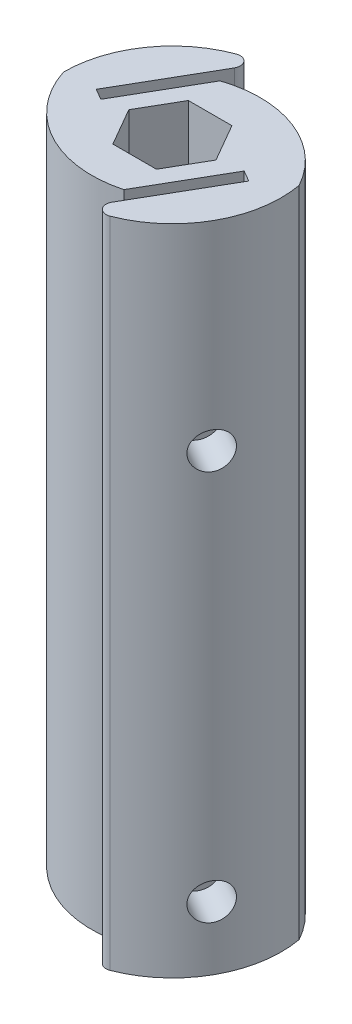
from build123d import *

# Parameters (mm, degrees)
BOSS_EXTRUDE1_DEPTH     = 114.3
CUT_EXTRUDE1_DEPTH      = 119.868393362
CUT_EXTRUDE1_DEPTH_BACK = 119.868393362
SKETCH2_R               = 3.175


with BuildPart() as part:
    # Sketch1 → Boss-Extrude1 (new body)
    with BuildSketch(Plane(origin=(0, 0, 0), x_dir=(1, 0, 0), z_dir=(0, 1, 0))):
        with BuildLine():
            Line((4.052973773, -12.538043503), (11.754987424, 0.80223546))
            Line((11.754987424, 0.80223546), (13.679728884, -0.30901454))
            Line((13.679728884, -0.30901454), (4.910037862, -15.498564956))
            ThreePointArc((4.910037862, -15.498564956), (5.078558502, -17.32430787), (6.856203481, -17.773434497))
            ThreePointArc((6.856203481, -17.773434497), (16.623747328, -9.303414683), (18.73470204, 3.451585069))
            ThreePointArc((18.73470204, 3.451585069), (8.97391608, 12.027162481), (-4.01489639, 12.349995465))
            Line((-4.01489639, 12.349995465), (-11.645002197, -0.86573546))
            Line((-11.645002197, -0.86573546), (-13.569743657, 0.24551454))
            Line((-13.569743657, 0.24551454), (-4.722290977, 15.569752099))
            ThreePointArc((-4.722290977, 15.569752099), (-4.884898453, 17.388542767), (-6.651388697, 17.851093199))
            ThreePointArc((-6.651388697, 17.851093199), (-15.646268799, 10.867233901), (-19.05, 0))
            ThreePointArc((-19.05, 0), (-10.00744853, -10.892061153), (4.052973773, -12.538043503))
        make_face()
        Polygon((3.812821178, -6.604), (7.625642355, 0), (3.812821178, 6.604), (-3.812821178, 6.604), (-7.625642355, 0), (-3.812821178, -6.604), align=None, mode=Mode.SUBTRACT)
    extrude(amount=BOSS_EXTRUDE1_DEPTH)

    # Sketch2 → Cut-Extrude1 (cut, two sides: drawn at the far end of the back side and taken through both)
    with BuildSketch(Plane(origin=(5.719231767, 0, 3.302), x_dir=(-0.5000000000000001, 0, 0.8660254037844386), z_dir=(-0.8660254037844386, 0, -0.5000000000000001)).offset(-CUT_EXTRUDE1_DEPTH_BACK)):
        with Locations(Location((0, 11.1125, 0), (0, 0, 180))):
            Circle(SKETCH2_R)
        with Locations(Location((0, 79.4385, 0), (0, 0, 180))):
            Circle(SKETCH2_R)
    extrude(amount=CUT_EXTRUDE1_DEPTH + CUT_EXTRUDE1_DEPTH_BACK, mode=Mode.SUBTRACT)


solid = part.part
